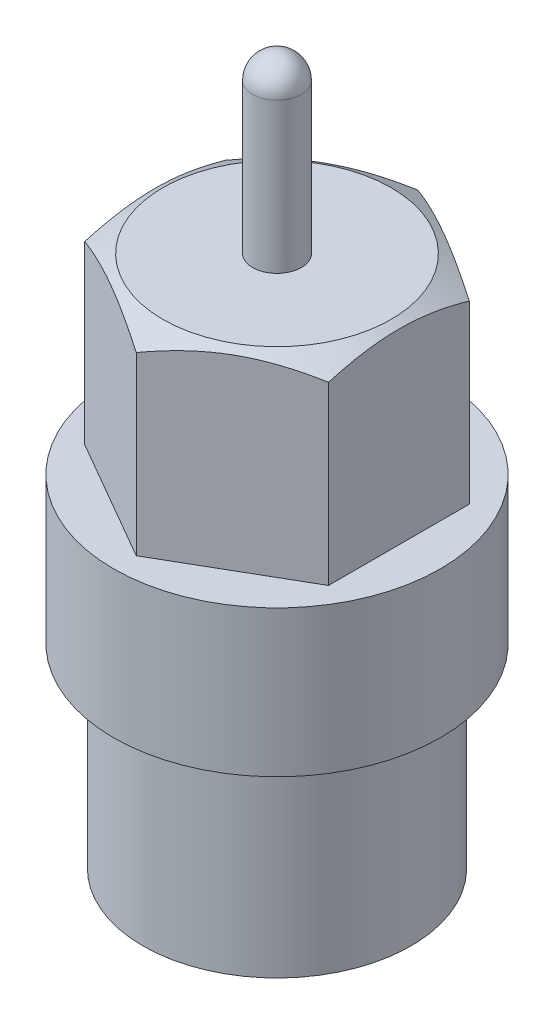
from build123d import *

# Parameters (mm, degrees)
ESQUISSE2_OUTSIDE_W     = 12.304
ESQUISSE2_OUTSIDE_H     = 12.304
ENL_V_MAT_EXTRU_1_DEPTH = 3.924186047


with BuildPart() as part:
    # Esquisse1 → Base-Révolution (revolve)
    with BuildSketch(Plane.XY, mode=Mode.PRIVATE) as base_r_volution_sk:
        with BuildLine():
            Line((-0.531153927, 0), (-2.75, 0))
            Line((-2.75, 0), (-2.75, 4))
            Line((-2.75, 4), (-3.352191691, 4))
            Line((-3.352191691, 4), (-3.352191691, 7))
            Line((-3.352191691, 7), (-3, 7))
            Line((-3, 7), (-3, 10.543617096))
            Line((-3, 10.543617096), (-2.340835241, 10.924186047))
            Line((-2.340835241, 10.924186047), (-0.5, 10.924186047))
            Line((-0.5, 10.924186047), (-0.5, 14))
            ThreePointArc((-0.5, 14), (-0.353553391, 14.353553391), (0, 14.5))
            Line((0, 14.5), (0, -0.8))
            Line((0, -0.8), (-0.531153927, 0))
        make_face()
    revolve(base_r_volution_sk.sketch.rotate(Axis((0, 14.968764899, 0), (0, -1, 0)), 270), axis=Axis((0, 14.968764899, 0), (0, -1, 0)))

    # Esquisse2 outside → Enlèv. mat.-Extru.1 (cut)
    with BuildSketch(Plane(origin=(0, 10.924186047, 0), x_dir=(-1, 0, 0), z_dir=(0, 1, 0))):
        Rectangle(ESQUISSE2_OUTSIDE_W, ESQUISSE2_OUTSIDE_H)
        Polygon((0, 2.886751346), (-2.5, 1.443375673), (-2.5, -1.443375673), (0, -2.886751346), (2.5, -1.443375673), (2.5, 1.443375673), align=None, mode=Mode.SUBTRACT)
    extrude(amount=-ENL_V_MAT_EXTRU_1_DEPTH, mode=Mode.SUBTRACT)


solid = part.part
